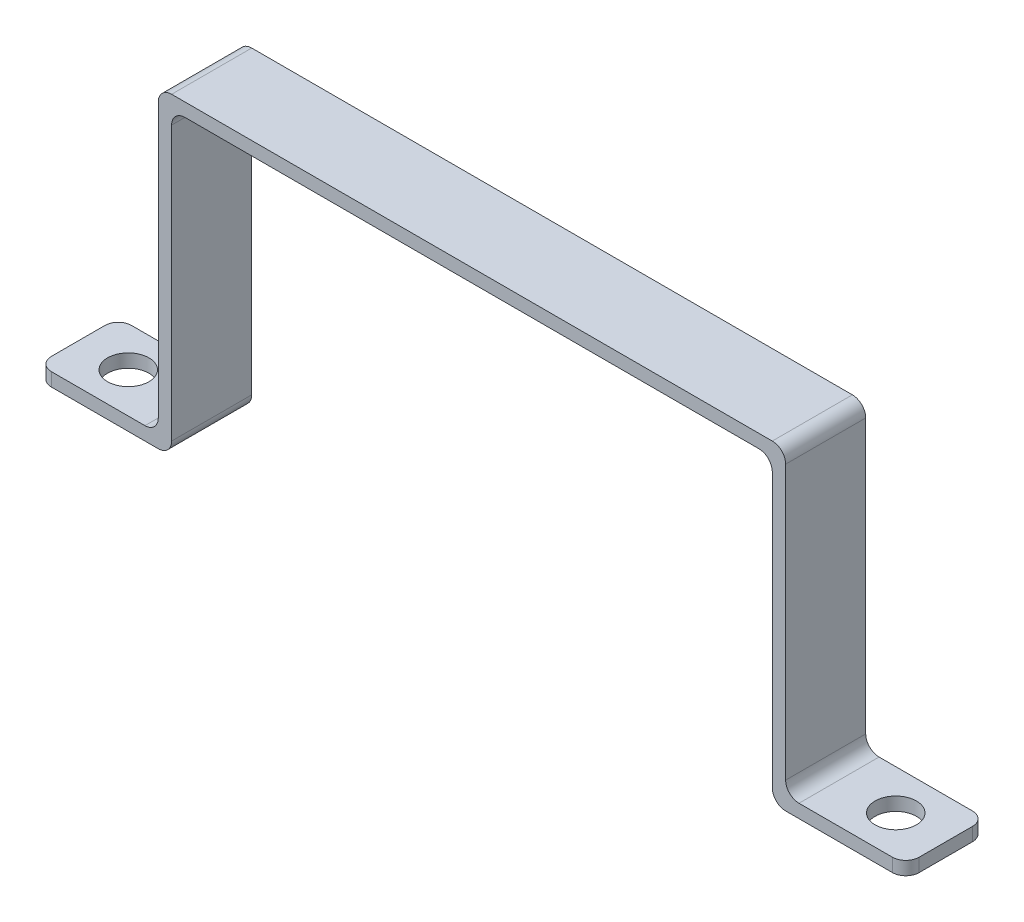
from build123d import *

# Parameters (mm, degrees)
EXTRUDE_1_DEPTH     = 12
FILLET_1_R          = 2
SKETCH_2_R          = 3.1
CUT_EXTRUDE_1_DEPTH = 12


with BuildPart() as part:
    # ｽｹｯﾁ1 → ﾎﾞｽ - 押し出し1 (new body)
    with BuildSketch(Plane.XY):
        Polygon((47, 0), (-47, 0), (-47, -45), (-65, -45), (-65, -47), (-45, -47), (-45, -2), (45, -2), (45, -47), (65, -47), (65, -45), (47, -45), align=None)
    extrude(amount=EXTRUDE_1_DEPTH)

    # ﾌｨﾚｯﾄ1
    fillet_1_edges = [part.edges().sort_by_distance(p)[0] for p in [
        (65, -46, 0),
        (-65, -46, 0),
        (-65, -46, 12),
        (45, -47, 6),
        (45, -2, 6),
        (-45, -2, 6),
        (-45, -47, 6),
        (-47, -45, 6),
        (-47, 0, 6),
        (47, 0, 6),
        (47, -45, 6),
        (65, -46, 12),
    ]]
    fillet(fillet_1_edges, radius=FILLET_1_R)

    # ｽｹｯﾁ2 → ｶｯﾄ - 押し出し1 (cut)
    with BuildSketch(Plane(origin=(0, -45, 0), x_dir=(1, 0, 0), z_dir=(0, 1, 0))):
        with Locations(Location((-57.5, -6, 0), (0, 0, 180))):
            Circle(SKETCH_2_R)
        with Locations(Location((57.5, -6, 0), (0, 0, 180))):
            Circle(SKETCH_2_R)
    extrude(amount=-CUT_EXTRUDE_1_DEPTH, mode=Mode.SUBTRACT)


solid = part.part
